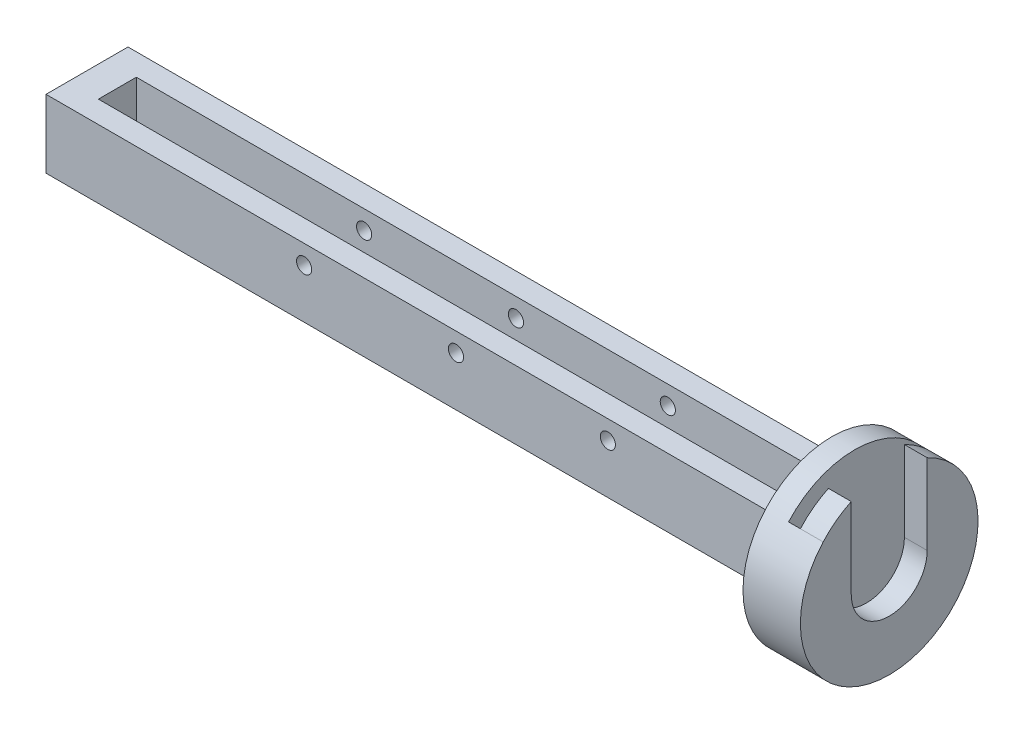
from build123d import *

# Parameters (mm, degrees)
SKETCH1_W           = 10.8
SKETCH1_H           = 9
BOSS_EXTRUDE1_DEPTH = 4
BOSS_EXTRUDE2_DEPTH = 90
SKETCH3_W           = 10.8
SKETCH3_H           = 9
BOSS_EXTRUDE3_DEPTH = 4
SKETCH4_R           = 11.7
BOSS_EXTRUDE4_DEPTH = 3
BOSS_EXTRUDE5_DEPTH = 1.56
BOSS_EXTRUDE6_DEPTH = 3
SKETCH7_R           = 1
CUT_EXTRUDE2_DEPTH  = 11


with BuildPart() as part:
    # Sketch1 → Boss-Extrude1 (new body)
    with BuildSketch(Plane(origin=(0, 0, 0), x_dir=(0, 0, -1), z_dir=(1, 0, 0))):
        with Locations((5.4, 4.5)):
            Rectangle(SKETCH1_W, SKETCH1_H)
    extrude(amount=BOSS_EXTRUDE1_DEPTH)

    # Sketch2 → Boss-Extrude2 (add)
    with BuildSketch(Plane(origin=(4, 0, 0), x_dir=(0, 0, -1), z_dir=(1, 0, 0))):
        Polygon((0, 9), (0, 0), (10.8, 0), (10.8, 9), (7.9, 9), (7.9, 3), (2.9, 3), (2.9, 9), align=None)
    extrude(amount=BOSS_EXTRUDE2_DEPTH)

    # Sketch3 → Boss-Extrude3 (add)
    with BuildSketch(Plane(origin=(94, 0, 0), x_dir=(0, 0, -1), z_dir=(1, 0, 0))):
        with Locations((5.4, 4.5)):
            Rectangle(SKETCH3_W, SKETCH3_H)
    extrude(amount=BOSS_EXTRUDE3_DEPTH)

    # Sketch4 → Boss-Extrude4 (add)
    with BuildSketch(Plane(origin=(98, 0, 0), x_dir=(0, 0, -1), z_dir=(1, 0, 0))):
        with Locations((5.5, 4.5)):
            Circle(SKETCH4_R)
    extrude(amount=BOSS_EXTRUDE4_DEPTH)

    # Sketch5 → Boss-Extrude5 (add)
    with BuildSketch(Plane(origin=(101, 0, 0), x_dir=(0, 0, -1), z_dir=(1, 0, 0))):
        with BuildLine():
            Line((-3.2, 4.5), (-3.2, 12.323042886))
            ThreePointArc((-3.2, 12.323042886), (5.5, -7.2), (14.2, 12.323042886))
            Line((14.2, 12.323042886), (14.2, 4.5))
            ThreePointArc((14.2, 4.5), (5.5, -4.2), (-3.2, 4.5))
        make_face()
    extrude(amount=BOSS_EXTRUDE5_DEPTH)

    # Sketch6 → Boss-Extrude6 (add)
    with BuildSketch(Plane(origin=(102.56, 0, 0), x_dir=(0, 0, -1), z_dir=(1, 0, 0))):
        with BuildLine():
            Line((0.5, 4.5), (0.5, 15.077806956))
            ThreePointArc((0.5, 15.077806956), (5.5, -7.2), (10.5, 15.077806956))
            Line((10.5, 15.077806956), (10.5, 4.5))
            ThreePointArc((10.5, 4.5), (5.5, -0.5), (0.5, 4.5))
        make_face()
    extrude(amount=BOSS_EXTRUDE6_DEPTH)

    # Sketch7 → Cut-Extrude2 (cut)
    with BuildSketch(Plane.XY):
        with Locations((34, 6.5)):
            Circle(SKETCH7_R)
        with Locations((54, 6.5)):
            Circle(SKETCH7_R)
        with Locations((74, 6.5)):
            Circle(SKETCH7_R)
    extrude(amount=-CUT_EXTRUDE2_DEPTH, mode=Mode.SUBTRACT)


solid = part.part
